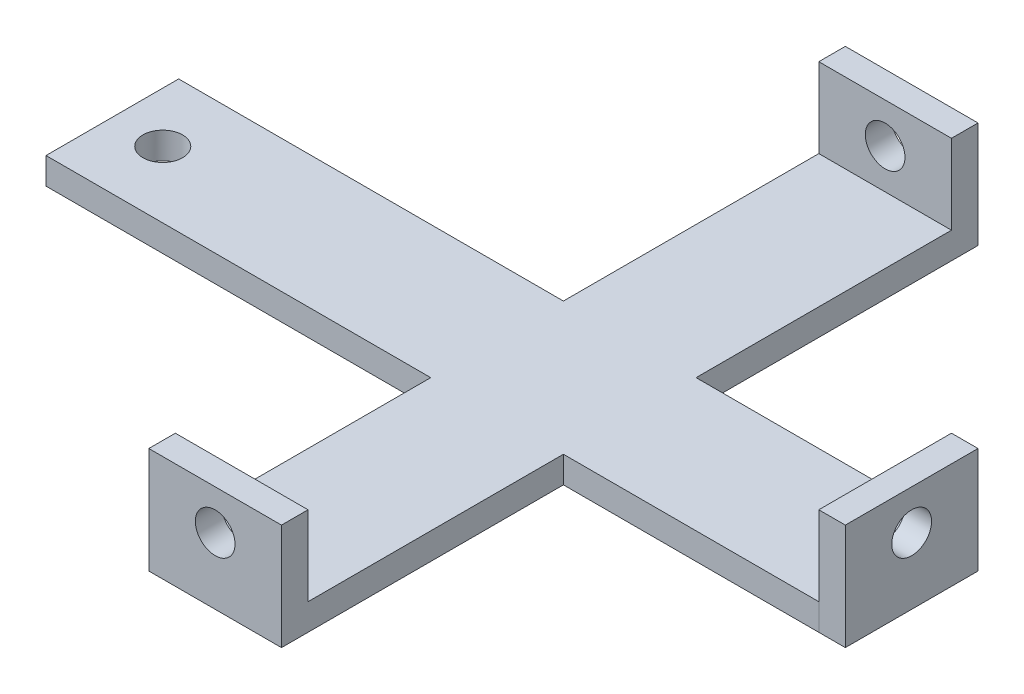
from build123d import *

# Parameters (mm, degrees)
EXTRUDE_THIN1_DEPTH       = 12.7
F_6_CLEARANCE_HOLE1_D     = 3.7973
F_6_CLEARANCE_HOLE1_DEPTH = 7.62
F_6_CLEARANCE_HOLE1_TIP   = 1.140824014
F_6_CLEARANCE_HOLE2_D     = 3.7973
F_6_CLEARANCE_HOLE2_DEPTH = 7.62
F_6_CLEARANCE_HOLE2_TIP   = 1.140824014
SKETCH6_W                 = 12.7
SKETCH6_H                 = 2.54
BOSS_EXTRUDE1_DEPTH       = 24.4475
SKETCH7_W                 = 12.7
SKETCH7_H                 = 10.16
BOSS_EXTRUDE2_DEPTH       = 2.54
SKETCH9_R                 = 1.905
CUT_EXTRUDE1_DEPTH        = 2.54
SKETCH10_W                = 12.7
SKETCH10_H                = 2.54
BOSS_EXTRUDE3_DEPTH       = 36.83
SKETCH12_W                = 1.89865
SKETCH12_H                = 2.54105


with BuildPart() as part:
    # Sketch1 → Extrude-Thin1 (new body)
    with BuildSketch(Plane(origin=(0, 0, 0), x_dir=(0, 0, -1), z_dir=(1, 0, 0))):
        Polygon((-1.27, 15.748), (-1.27, 8.128), (60.325, 8.128), (60.325, 15.748), (62.865, 15.748), (62.865, 5.588), (-3.81, 5.588), (-3.81, 15.748), align=None)
    extrude(amount=EXTRUDE_THIN1_DEPTH)

    # #6 Clearance Hole1
    with Locations(Plane(origin=(0, 0, 1.27), x_dir=(-1, 0, 0), z_dir=(0, 0, -1))):
        with Locations((-6.35, 11.938)):
            Hole(F_6_CLEARANCE_HOLE1_D / 2, depth=F_6_CLEARANCE_HOLE1_DEPTH)
            with Locations((0, 0, -(F_6_CLEARANCE_HOLE1_DEPTH + F_6_CLEARANCE_HOLE1_TIP / 2))):  # 118° drill point
                Cone(0, F_6_CLEARANCE_HOLE1_D / 2, F_6_CLEARANCE_HOLE1_TIP, mode=Mode.SUBTRACT)

    # #6 Clearance Hole2
    with Locations(Plane.XY.offset(-60.325)):
        with Locations((6.35, 11.938)):
            Hole(F_6_CLEARANCE_HOLE2_D / 2, depth=F_6_CLEARANCE_HOLE2_DEPTH)
            with Locations((0, 0, -(F_6_CLEARANCE_HOLE2_DEPTH + F_6_CLEARANCE_HOLE2_TIP / 2))):  # 118° drill point
                Cone(0, F_6_CLEARANCE_HOLE2_D / 2, F_6_CLEARANCE_HOLE2_TIP, mode=Mode.SUBTRACT)

    # Sketch6 → Boss-Extrude1 (add)
    with BuildSketch(Plane(origin=(12.7, 0, 0), x_dir=(0, 0, -1), z_dir=(1, 0, 0))):
        with Locations((29.5275, 6.858)):
            Rectangle(SKETCH6_W, SKETCH6_H)
    extrude(amount=BOSS_EXTRUDE1_DEPTH)

    # Sketch10 → Boss-Extrude3 (add)
    with BuildSketch(Plane.ZY):
        with Locations((-29.5275, 6.858)):
            Rectangle(SKETCH10_W, SKETCH10_H)
    extrude(amount=BOSS_EXTRUDE3_DEPTH)

    # Sketch12 → #6 Clearance Hole3 (revolve, cut)
    with BuildSketch(Plane(origin=(-32.004, 8.128, -29.5275), x_dir=(0, 0, 1), z_dir=(1, 0, 0))):
        with Locations((0.949325, 1.270525)):
            Rectangle(SKETCH12_W, SKETCH12_H)
    revolve(axis=Axis((-32.004, 14.478, -29.5275), (0, -1, 0)), mode=Mode.SUBTRACT)


with BuildPart() as body_2:
    # Sketch7 → Boss-Extrude2 (new body)
    with BuildSketch(Plane(origin=(37.1475, 0, 0), x_dir=(0, 0, -1), z_dir=(1, 0, 0))):
        with Locations((29.5275, 10.668)):
            Rectangle(SKETCH7_W, SKETCH7_H)
    extrude(amount=BOSS_EXTRUDE2_DEPTH)

    # Sketch9 → Cut-Extrude1 (cut)
    with BuildSketch(Plane(origin=(39.6875, 0, 0), x_dir=(0, 0, -1), z_dir=(1, 0, 0))):
        with Locations((29.5275, 11.938)):
            Circle(SKETCH9_R)
    extrude(amount=-CUT_EXTRUDE1_DEPTH, mode=Mode.SUBTRACT)


solid = Compound([part.part, body_2.part])
